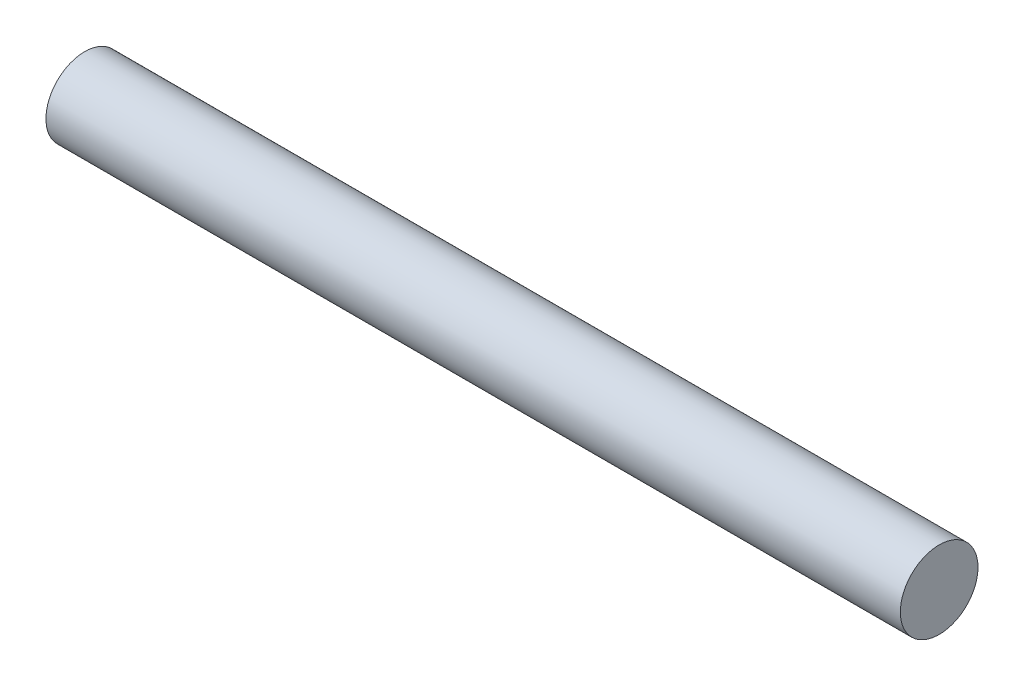
from build123d import *

# Parameters (mm, degrees)
SKETCH2_R           = 2.54
BOSS_EXTRUDE1_DEPTH = 55.88


with BuildPart() as part:
    # Sketch2 → Boss-Extrude1 (new body)
    with BuildSketch(Plane(origin=(0, 0, 0), x_dir=(0, 0, -1), z_dir=(1, 0, 0))):
        Circle(SKETCH2_R)
    extrude(amount=BOSS_EXTRUDE1_DEPTH)


solid = part.part
